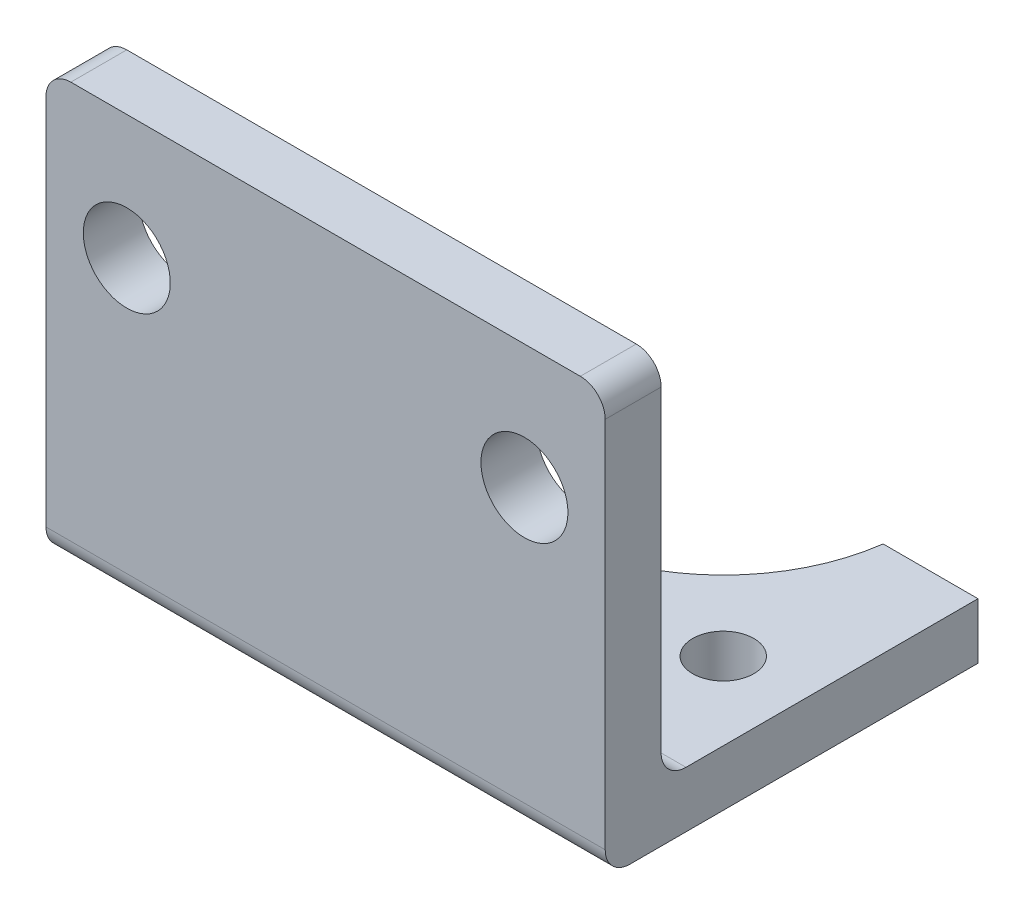
from build123d import *

# Parameters (mm, degrees)
CROQUIS1_R                   = 2.46
SALIENTE_EXTRUIR1_DEPTH      = 4.5
SALIENTE_EXTRUIR2_DEPTH      = 22.5
SALIENTE_EXTRUIR2_DEPTH_BACK = 22.5
CROQUIS2_W                   = 4.5
CROQUIS2_H                   = 34
CROQUIS3_R                   = 3.5
CORTAR_EXTRUIR1_DEPTH        = 22.5
REDONDEO1_R                  = 2
REDONDEO2_R                  = 2
REDONDEO3_R                  = 2


with BuildPart() as part:
    # Croquis1 → Saliente-Extruir1 (new body)
    with BuildSketch(Plane(origin=(0, 0, 0), x_dir=(1, 0, 0), z_dir=(0, 1, 0))):
        with BuildLine():
            Line((22.5, 0), (-22.5, 0))
            Line((-22.5, 0), (-22.5, 30))
            Line((-22.5, 30), (-14.866068747, 30))
            ThreePointArc((-14.866068747, 30), (0, 17), (14.866068747, 30))
            Line((14.866068747, 30), (22.5, 30))
            Line((22.5, 30), (22.5, 0))
        make_face()
        with Locations((-16.25, 15.75)):
            Circle(CROQUIS1_R, mode=Mode.SUBTRACT)
        with Locations((16.25, 15.75)):
            Circle(CROQUIS1_R, mode=Mode.SUBTRACT)
    extrude(amount=SALIENTE_EXTRUIR1_DEPTH)

    # Croquis2 → Saliente-Extruir2 (add, two sides: drawn at the far end of the back side and taken through both)
    with BuildSketch(Plane(origin=(0, 0, 0), x_dir=(0, 0, -1), z_dir=(1, 0, 0)).offset(-SALIENTE_EXTRUIR2_DEPTH_BACK)):
        with Locations((2.25, 17)):
            Rectangle(CROQUIS2_W, CROQUIS2_H)
    extrude(amount=SALIENTE_EXTRUIR2_DEPTH + SALIENTE_EXTRUIR2_DEPTH_BACK)

    # Croquis3 → Cortar-Extruir1 (cut)
    with BuildSketch(Plane(origin=(0, 0, -4.5), x_dir=(-1, 0, 0), z_dir=(0, 0, -1))):
        with Locations((-16, 24)):
            Circle(CROQUIS3_R)
        with Locations((16, 24)):
            Circle(CROQUIS3_R)
    extrude(amount=-CORTAR_EXTRUIR1_DEPTH, mode=Mode.SUBTRACT)

    # Redondeo1
    redondeo1_edges = [part.edges().sort_by_distance(p)[0] for p in [
        (0, 0, 0),
    ]]
    fillet(redondeo1_edges, radius=REDONDEO1_R)

    # Redondeo2
    redondeo2_edges = [part.edges().sort_by_distance(p)[0] for p in [
        (0, 4.5, -4.5),
    ]]
    fillet(redondeo2_edges, radius=REDONDEO2_R)

    # Redondeo3
    redondeo3_edges = [part.edges().sort_by_distance(p)[0] for p in [
        (22.5, 34, -2.25),
        (-22.5, 34, -2.25),
    ]]
    fillet(redondeo3_edges, radius=REDONDEO3_R)


solid = part.part
